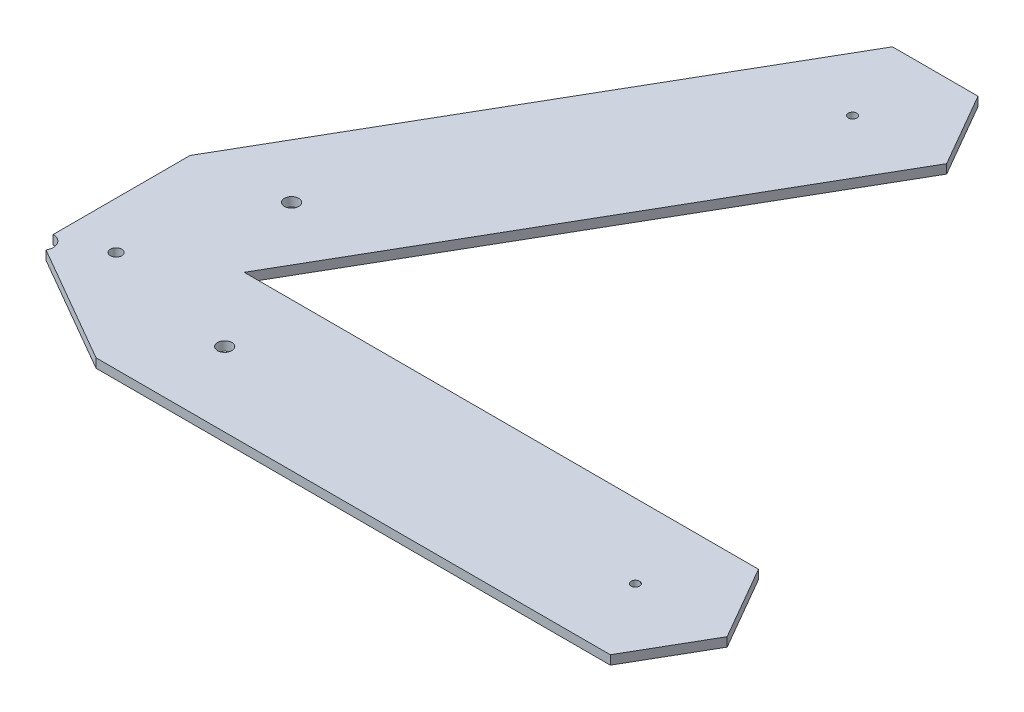
from build123d import *

# Parameters (mm, degrees)
SKETCH1_R           = 1.5
SKETCH1_R_2         = 2
SKETCH1_R_3         = 2.5
SKETCH1_R_4         = 3.96875
BOSS_EXTRUDE1_DEPTH = 3.175
CUT_EXTRUDE1_START  = -3.175
SKETCH2_R           = 3.96875
SKETCH2_R_2         = 1.5
SKETCH2_R_3         = 2
SKETCH2_R_4         = 2.5
CUT_EXTRUDE1_DEPTH  = 3.175


with BuildPart() as part:
    # Sketch1 → Boss-Extrude1 (new body)
    with BuildSketch(Plane(origin=(0, 0, 0), x_dir=(1, 0, 0), z_dir=(0, 1, 0))):
        Polygon((240.38814, 0), (225.38814, 25.980762114), (45, 25.980762114), (135.19407, 182.201473895), (120.19407, 208.182236008), (90.19407, 208.182236008), (0, 51.961524227), (-90.19407, 208.182236008), (-120.19407, 208.182236008), (-135.19407, 182.201473895), (-45, 25.980762114), (-225.38814, 25.980762114), (-240.38814, 0), (-225.38814, -25.980762114), (-45, -25.980762114), (-135.19407, -182.201473895), (-120.19407, -208.182236008), (-90.19407, -208.182236008), (0, -51.961524227), (90.19407, -208.182236008), (120.19407, -208.182236008), (135.19407, -182.201473895), (45, -25.980762114), (225.38814, -25.980762114), align=None)
        with Locations(Location((208.18221, 0, 0), (0, 0, 270))):
            Circle(SKETCH1_R, mode=Mode.SUBTRACT)
        with Locations(Location((104.091105, -180.291082476, 0), (0, 0, 270))):
            Circle(SKETCH1_R, mode=Mode.SUBTRACT)
        with Locations(Location((-104.091105, -180.291082476, 0), (0, 0, 270))):
            Circle(SKETCH1_R, mode=Mode.SUBTRACT)
        with Locations(Location((-208.18221, 0, 0), (0, 0, 270))):
            Circle(SKETCH1_R, mode=Mode.SUBTRACT)
        with Locations(Location((-104.091105, 180.291082476, 0), (0, 0, 270))):
            Circle(SKETCH1_R, mode=Mode.SUBTRACT)
        with Locations(Location((104.091105, 180.291082476, 0), (0, 0, 270))):
            Circle(SKETCH1_R, mode=Mode.SUBTRACT)
        with Locations(Location((16.497783942, 9.525, 0), (0, 0, 270))):
            Circle(SKETCH1_R_2, mode=Mode.SUBTRACT)
        with Locations(Location((0, -19.05, 0), (0, 0, 270))):
            Circle(SKETCH1_R_2, mode=Mode.SUBTRACT)
        with Locations(Location((-16.497783942, 9.525, 0), (0, 0, 270))):
            Circle(SKETCH1_R_2, mode=Mode.SUBTRACT)
        with Locations(Location((32.066865, 55.541439419, 0), (0, 0, 270))):
            Circle(SKETCH1_R_3, mode=Mode.SUBTRACT)
        with Locations(Location((64.13373, 0, 0), (0, 0, 270))):
            Circle(SKETCH1_R_3, mode=Mode.SUBTRACT)
        with Locations(Location((32.066865, -55.541439419, 0), (0, 0, 270))):
            Circle(SKETCH1_R_3, mode=Mode.SUBTRACT)
        with Locations(Location((-32.066865, -55.541439419, 0), (0, 0, 270))):
            Circle(SKETCH1_R_3, mode=Mode.SUBTRACT)
        with Locations(Location((-64.13373, 0, 0), (0, 0, 270))):
            Circle(SKETCH1_R_3, mode=Mode.SUBTRACT)
        with Locations(Location((-32.066865, 55.541439419, 0), (0, 0, 270))):
            Circle(SKETCH1_R_3, mode=Mode.SUBTRACT)
        with Locations(Location((0, 0, 0), (0, 0, 270))):
            Circle(SKETCH1_R_4, mode=Mode.SUBTRACT)
    extrude(amount=BOSS_EXTRUDE1_DEPTH)

    # Sketch2 → Cut-Extrude1 (cut)
    # profile 1 of 3: a face of its own
    with BuildSketch(Plane(origin=(0, 3.175, 0), x_dir=(1, 0, 0), z_dir=(0, 1, 0)).offset(CUT_EXTRUDE1_START)):
        with BuildLine():
            ThreePointArc((228.675327889, -132.025762114), (-228.675327889, -132.025762114), (0, 264.051524227))
            Line((0, 264.051524227), (0, 51.961524227))
            Line((0, 51.961524227), (-90.19407, 208.182236008))
            Line((-90.19407, 208.182236008), (-120.19407, 208.182236008))
            Line((-120.19407, 208.182236008), (-135.19407, 182.201473895))
            Line((-135.19407, 182.201473895), (-45, 25.980762114))
            Line((-45, 25.980762114), (-225.38814, 25.980762114))
            Line((-225.38814, 25.980762114), (-240.38814, 0))
            Line((-240.38814, 0), (-225.38814, -25.980762114))
            Line((-225.38814, -25.980762114), (-45, -25.980762114))
            Line((-45, -25.980762114), (-135.19407, -182.201473895))
            Line((-135.19407, -182.201473895), (-120.19407, -208.182236008))
            Line((-120.19407, -208.182236008), (-90.19407, -208.182236008))
            Line((-90.19407, -208.182236008), (0, -51.961524227))
            Line((0, -51.961524227), (90.19407, -208.182236008))
            Line((90.19407, -208.182236008), (120.19407, -208.182236008))
            Line((120.19407, -208.182236008), (135.19407, -182.201473895))
            Line((135.19407, -182.201473895), (45, -25.980762114))
            Line((45, -25.980762114), (228.675327889, -132.025762114))
        make_face()
    # profile 2 of 3: a face of its own
    with BuildSketch(Plane(origin=(0, 3.175, 0), x_dir=(1, 0, 0), z_dir=(0, 1, 0)).offset(CUT_EXTRUDE1_START)):
        Circle(SKETCH2_R)
    # profile 3 of 3: a face of its own
    with BuildSketch(Plane(origin=(0, 3.175, 0), x_dir=(1, 0, 0), z_dir=(0, 1, 0)).offset(CUT_EXTRUDE1_START)):
        Polygon((0, 0), (45, -25.980762114), (135.19407, -182.201473895), (120.19407, -208.182236008), (90.19407, -208.182236008), (0, -51.961524227), (-90.19407, -208.182236008), (-120.19407, -208.182236008), (-135.19407, -182.201473895), (-45, -25.980762114), (-225.38814, -25.980762114), (-240.38814, 0), (-225.38814, 25.980762114), (-45, 25.980762114), (-135.19407, 182.201473895), (-120.19407, 208.182236008), (-90.19407, 208.182236008), (0, 51.961524227), align=None)
        with Locations((104.091105, -180.291082476)):
            Circle(SKETCH2_R_2, mode=Mode.SUBTRACT)
        with Locations((-208.18221, 0)):
            Circle(SKETCH2_R_2, mode=Mode.SUBTRACT)
        with Locations((-104.091105, 180.291082476)):
            Circle(SKETCH2_R_2, mode=Mode.SUBTRACT)
        with Locations((-16.497783942, 9.525)):
            Circle(SKETCH2_R_3, mode=Mode.SUBTRACT)
        with Locations((0, -19.05)):
            Circle(SKETCH2_R_3, mode=Mode.SUBTRACT)
        with Locations((-32.066865, 55.541439419)):
            Circle(SKETCH2_R_4, mode=Mode.SUBTRACT)
        with Locations((-64.13373, 0)):
            Circle(SKETCH2_R_4, mode=Mode.SUBTRACT)
        with Locations((-32.066865, -55.541439419)):
            Circle(SKETCH2_R_4, mode=Mode.SUBTRACT)
        with Locations((-104.091105, -180.291082476)):
            Circle(SKETCH2_R_2, mode=Mode.SUBTRACT)
        with Locations((32.066865, -55.541439419)):
            Circle(SKETCH2_R_4, mode=Mode.SUBTRACT)
    extrude(amount=CUT_EXTRUDE1_DEPTH, mode=Mode.SUBTRACT)


solid = part.part
